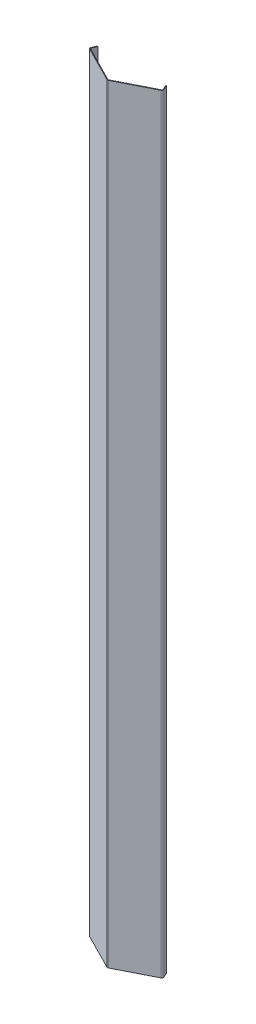
from build123d import *

# Parameters (mm, degrees)
BOSS_EXTRUDE2_DEPTH = 4710


with BuildPart() as part:
    # Sketch1 → Boss-Extrude2 (new body)
    with BuildSketch(Plane(origin=(0, 0, 0), x_dir=(1, 0, 0), z_dir=(0, 1, 0))):
        with BuildLine():
            Line((319.222222222, 134.965277778), (331.494858512, 107.65046142))
            ThreePointArc((331.494858512, 107.65046142), (331.801527991, 100.219250383), (326.892771492, 94.631670113))
            Line((326.892771492, 94.631670113), (112.709917293, -13.883323219))
            ThreePointArc((112.709917293, -13.883323219), (108.190412513, -14.962892929), (103.670907733, -13.883323219))
            Line((103.670907733, -13.883323219), (-110.511946465, 94.631670113))
            ThreePointArc((-110.511946465, 94.631670113), (-115.420702964, 100.219250383), (-115.114033485, 107.65046142))
            Line((-115.114033485, 107.65046142), (-102.841397196, 134.965277778))
            Line((-102.841397196, 134.965277778), (-99.192760475, 133.325933371))
            Line((-99.192760475, 133.325933371), (-111.465396765, 106.011117013))
            ThreePointArc((-111.465396765, 106.011117013), (-111.649398452, 101.552390391), (-108.704144553, 98.199842229))
            Line((-108.704144553, 98.199842229), (105.478709645, -10.315151103))
            ThreePointArc((105.478709645, -10.315151103), (108.190412513, -10.962892929), (110.902115381, -10.315151103))
            Line((110.902115381, -10.315151103), (325.08496958, 98.199842229))
            ThreePointArc((325.08496958, 98.199842229), (328.030223479, 101.552390391), (327.846221792, 106.011117013))
            Line((327.846221792, 106.011117013), (315.573585502, 133.325933371))
            Line((315.573585502, 133.325933371), (319.222222222, 134.965277778))
        make_face()
    extrude(amount=BOSS_EXTRUDE2_DEPTH)


solid = part.part
